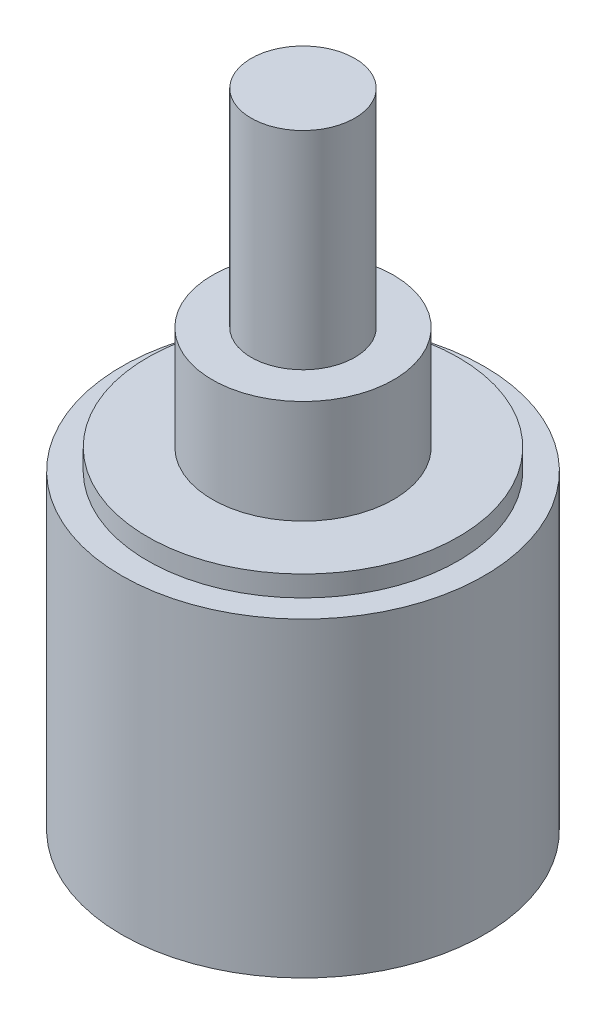
from build123d import *


with BuildPart() as part:
    # Sketch1 → Revolve1 (revolve)
    with BuildSketch(Plane.XY, mode=Mode.PRIVATE) as revolve1_sk:
        Polygon((11.1125, 19.05), (9.525, 19.05), (9.525, 20.32), (5.55625, 20.32), (5.55625, 26.67), (3.175, 26.67), (3.175, 39.37), (0, 39.37), (0, 0), (11.1125, 0), align=None)
    revolve(revolve1_sk.sketch.rotate(Axis((0, 0, 0), (0, 1, 0)), 90), axis=Axis((0, 0, 0), (0, 1, 0)))


solid = part.part
